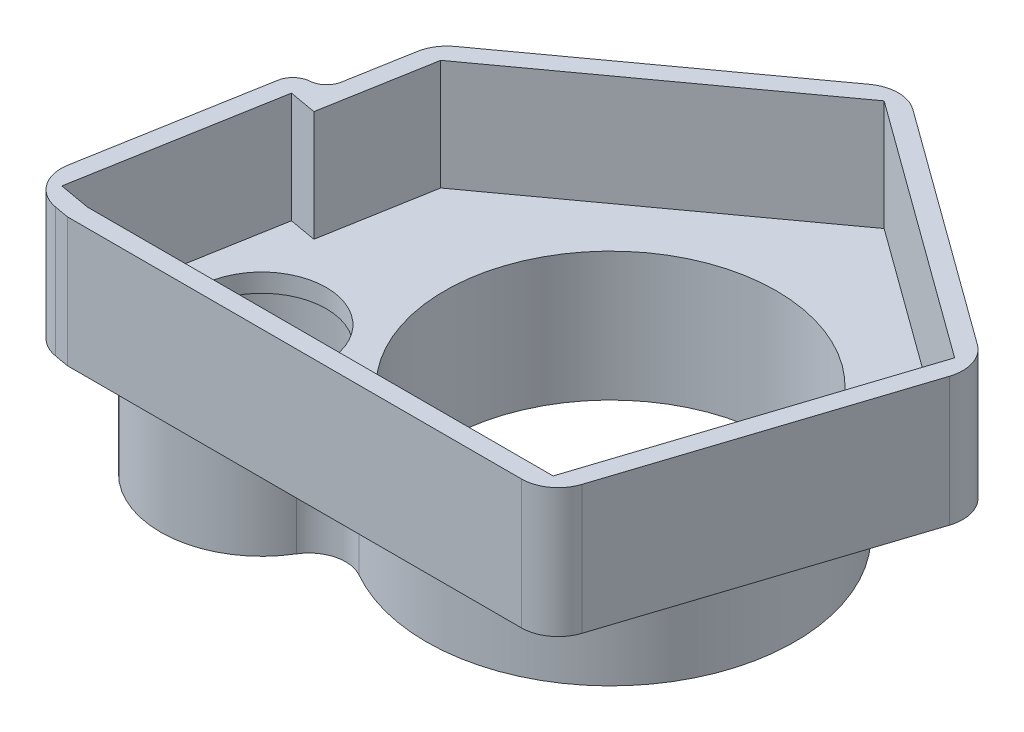
from build123d import *

# Parameters (mm, degrees)
SKETCH1_R               = 45
BOSS_EXTRUDE1_DEPTH     = 35
CUT_EXTRUDE1_DEPTH      = 30
BOSS_EXTRUDE6_START     = 30
SKETCH4_R               = 22.5
SKETCH4_R_2             = 45
BOSS_EXTRUDE6_DEPTH     = 30
CUT_EXTRUDE5_DEPTH      = 233.326481949
CUT_EXTRUDE5_DEPTH_BACK = 233.326481949
SKETCH11_R              = 17.5
FILLET5_R               = 10
FILLET7_R               = 5
FILLET8_R               = 5


with BuildPart() as part:
    # Sketch1 → Boss-Extrude1 (new body)
    with BuildSketch(Plane(origin=(0, 0, 0), x_dir=(1, 0, 0), z_dir=(0, 1, 0))):
        Polygon((46.859255168, 63.80155033), (-83.545615043, 63.80155033), (-97.357476794, 66.23695421), (-86.281022646, 129.054647247), (-78.894964498, 127.752285914), (-74.254340533, 154.070572239), (0, 208.019508525), (75.819867549, 152.933150283), align=None)
        with Locations(Location((0, 127.60310066, 0), (0, 0, 90))):
            Circle(SKETCH1_R, mode=Mode.SUBTRACT)
    extrude(amount=BOSS_EXTRUDE1_DEPTH)

    # Sketch2 → Cut-Extrude1 (cut)
    with BuildSketch(Plane(origin=(0, 35, 0), x_dir=(1, 0, 0), z_dir=(0, 1, 0))):
        Polygon((69.942015026, 151.023320226), (0, 201.839168637), (-69.681093857, 151.212890552), (-74.839166621, 121.960006261), (-82.225224769, 123.262367593), (-91.56519714, 70.292752087), (-83.108171726, 68.80155033), (43.226542528, 68.80155033), align=None)
    extrude(amount=-CUT_EXTRUDE1_DEPTH, mode=Mode.SUBTRACT)

    # Sketch4 → Boss-Extrude6 (add)
    with BuildSketch(Plane.XZ.offset(BOSS_EXTRUDE6_START)):
        with BuildLine():
            ThreePointArc((-38.294135291, -80.643268154), (-86.152709956, -81.952683716), (-60.360710902, -122.287910539))
            ThreePointArc((-60.360710902, -122.287910539), (-53.229459059, -124.750444519), (-49.848314613, -131.494826529))
            ThreePointArc((-49.848314613, -131.494826529), (44.180876901, -151.013570888), (-24.772660509, -84.171369273))
            ThreePointArc((-24.772660509, -84.171369273), (-32.2519207, -85.161062892), (-38.294135291, -80.643268154))
        make_face()
        with Locations(Location((-61.853227661, -94.828442341, 0), (0, 0, 270))):
            Circle(SKETCH4_R, mode=Mode.SUBTRACT)
        with Locations(Location((0, -127.60310066, 0), (0, 0, 270))):
            Circle(SKETCH4_R_2, mode=Mode.SUBTRACT)
    extrude(amount=-BOSS_EXTRUDE6_DEPTH)

    # Sketch11 → Cut-Extrude5 (cut, two sides: drawn at the far end of the back side and taken through both)
    with BuildSketch(Plane.XZ.offset(-CUT_EXTRUDE5_DEPTH_BACK)):
        with Locations(Location((-61.853227661, -94.828442341, 0), (0, 0, 270))):
            Circle(SKETCH11_R)
    extrude(amount=CUT_EXTRUDE5_DEPTH + CUT_EXTRUDE5_DEPTH_BACK, mode=Mode.SUBTRACT)

    # Fillet5
    fillet5_edges = [part.edges().sort_by_distance(p)[0] for p in [
        (-97.357476794, 17.5, -66.23695421),
        (-74.254340533, 17.5, -154.070572239),
        (0, 17.5, -208.019508525),
        (75.819867549, 17.5, -152.933150283),
        (46.859255168, 17.5, -63.80155033),
    ]]
    fillet(fillet5_edges, radius=FILLET5_R)

    # Fillet7
    fillet7_edges = [part.edges().sort_by_distance(p)[0] for p in [
        (-78.894964498, 17.5, -127.752285914),
    ]]
    fillet(fillet7_edges, radius=FILLET7_R)

    # Fillet8
    fillet8_edges = [part.edges().sort_by_distance(p)[0] for p in [
        (-86.281022646, 17.5, -129.054647247),
    ]]
    fillet(fillet8_edges, radius=FILLET8_R)


solid = part.part
